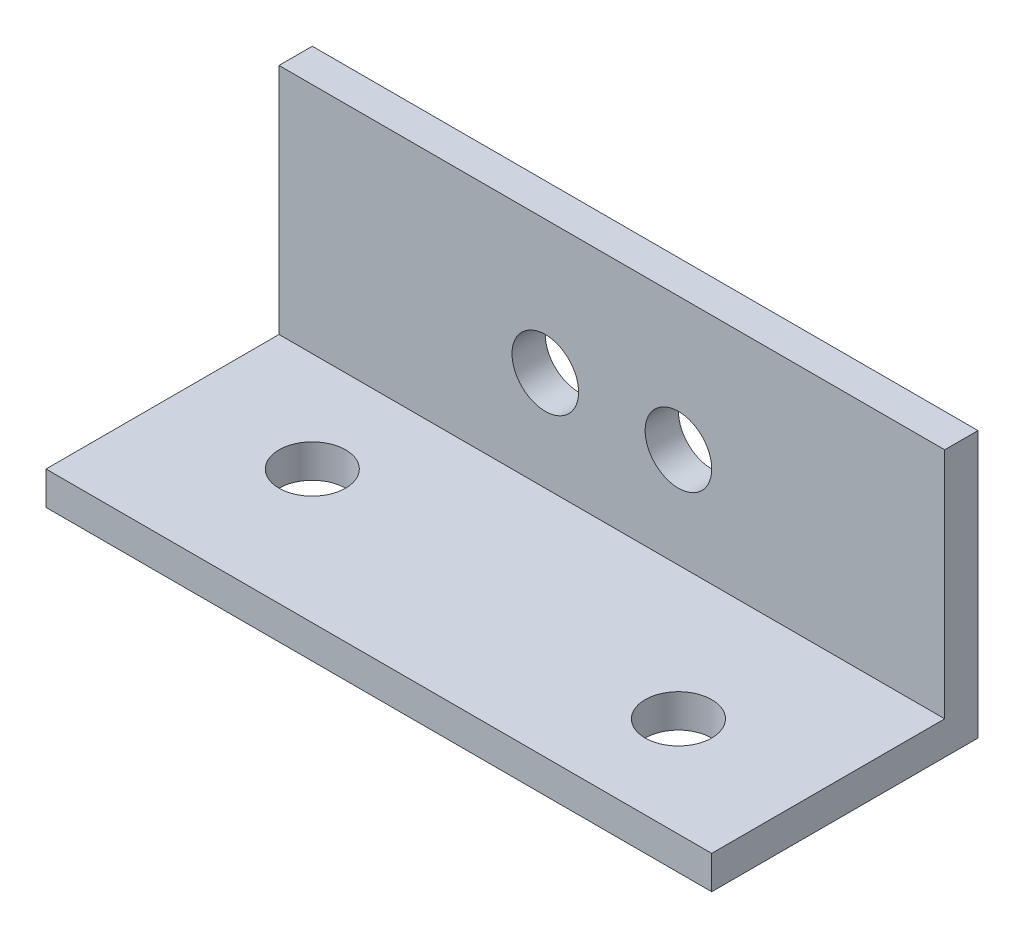
from build123d import *

# Parameters (mm, degrees)
SKETCH1_W           = 63.5
SKETCH1_H           = 25.4
BOSS_EXTRUDE1_DEPTH = 3.175
SKETCH2_W           = 63.5
SKETCH2_H           = 3.175
BOSS_EXTRUDE2_DEPTH = 22.225
SKETCH3_R           = 3.175
CUT_EXTRUDE1_DEPTH  = 3.175
SKETCH4_R           = 3.175
CUT_EXTRUDE2_DEPTH  = 3.175


with BuildPart() as part:
    # Sketch1 → Boss-Extrude1 (new body)
    with BuildSketch(Plane(origin=(0, 0, 0), x_dir=(1, 0, 0), z_dir=(0, 1, 0))):
        Rectangle(SKETCH1_W, SKETCH1_H)
    extrude(amount=BOSS_EXTRUDE1_DEPTH)

    # Sketch2 → Boss-Extrude2 (add)
    with BuildSketch(Plane(origin=(0, 3.175, 0), x_dir=(1, 0, 0), z_dir=(0, 1, 0))):
        with Locations((0, 11.1125)):
            Rectangle(SKETCH2_W, SKETCH2_H)
    extrude(amount=BOSS_EXTRUDE2_DEPTH)

    # Sketch3 → Cut-Extrude1 (cut)
    with BuildSketch(Plane.XY.offset(-9.525)):
        with Locations((-6.35, 12.7)):
            Circle(SKETCH3_R)
        with Locations((6.35, 12.7)):
            Circle(SKETCH3_R)
    extrude(amount=-CUT_EXTRUDE1_DEPTH, mode=Mode.SUBTRACT)

    # Sketch4 → Cut-Extrude2 (cut)
    with BuildSketch(Plane(origin=(0, 3.175, 0), x_dir=(1, 0, 0), z_dir=(0, 1, 0))):
        with Locations(Location((-19.05, 0, 0), (0, 0, 270))):
            Circle(SKETCH4_R)
        with Locations(Location((19.05, -3.175, 0), (0, 0, 270))):
            Circle(SKETCH4_R)
    extrude(amount=-CUT_EXTRUDE2_DEPTH, mode=Mode.SUBTRACT)


solid = part.part
